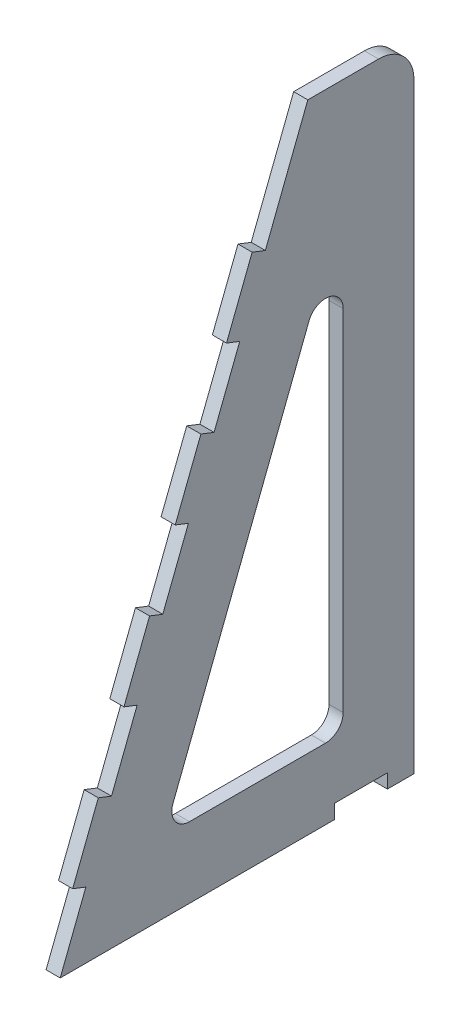
from build123d import *

# Parameters (mm, degrees)
ESTRUSIONE_ESTRUSIONE1_DEPTH = 4
ESTRUSIONE_ESTRUSIONE2_DEPTH = 4
RACCORDO2_R                  = 10
RACCORDO3_R                  = 5


with BuildPart() as part:
    # Schizzo1 → Estrusione-Estrusione1 (new body)
    with BuildSketch(Plane(origin=(0, 0, 0), x_dir=(0, 0, -1), z_dir=(1, 0, 0))):
        Polygon((70, 180), (0, 0), (77.5, 0), (77.5, 4), (92.5, 4), (92.5, 0), (100, 0), (100, 180), align=None)
        Polygon((80, 150.533691669), (80, 20), (29.236897684, 20), align=None, mode=Mode.SUBTRACT)
    extrude(amount=ESTRUSIONE_ESTRUSIONE1_DEPTH)

    # Schizzo2 → Estrusione-Estrusione2 (add)
    with BuildSketch(Plane(origin=(4, 0, 0), x_dir=(0, 0, -1), z_dir=(1, 0, 0))):
        Polygon((7.248925223, 18.640093431), (3.520906537, 20.089878475), (10.76983176, 38.729971906), (14.497850446, 37.280186862), align=None)
        Polygon((28.995700892, 74.560373723), (21.746775669, 55.920280292), (18.018756983, 57.370065337), (25.267682206, 76.010158768), align=None)
        Polygon((43.493551339, 111.840560585), (36.244626115, 93.200467154), (32.516607429, 94.650252199), (39.765532652, 113.29034563), align=None)
        Polygon((57.991401785, 149.120747447), (50.742476562, 130.480654016), (47.014457876, 131.93043906), (54.263383099, 150.570532491), align=None)
    extrude(amount=-ESTRUSIONE_ESTRUSIONE2_DEPTH)

    # Raccordo2
    raccordo2_edges = [part.edges().sort_by_distance(p)[0] for p in [
        (2, 180, -100),
    ]]
    fillet(raccordo2_edges, radius=RACCORDO2_R)

    # Raccordo3
    raccordo3_edges = [part.edges().sort_by_distance(p)[0] for p in [
        (2, 20, -80),
        (2, 150.533691669, -80),
        (2, 20, -29.236897684),
    ]]
    fillet(raccordo3_edges, radius=RACCORDO3_R)


solid = part.part
